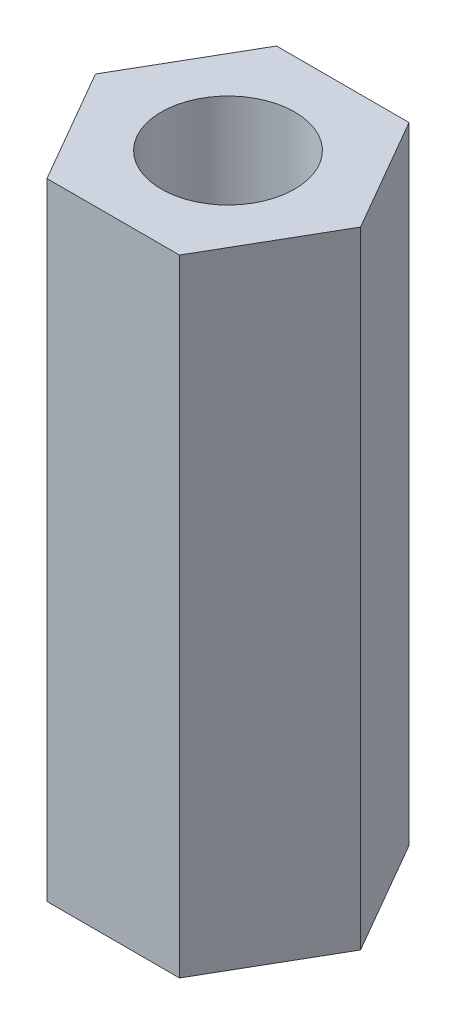
from build123d import *

# Parameters (mm, degrees)
EXTRUDE_1_DEPTH     = 15
SKETCH_2_R          = 1.6
CUT_EXTRUDE_1_DEPTH = 15


with BuildPart() as part:
    # 草图1 → 凸台-拉伸1 (new body)
    with BuildSketch(Plane(origin=(0, 0, 0), x_dir=(1, 0, 0), z_dir=(0, 1, 0))):
        Polygon((3.175426481, 0), (1.58771324, 2.75), (-1.58771324, 2.75), (-3.175426481, 0), (-1.58771324, -2.75), (1.58771324, -2.75), align=None)
    extrude(amount=EXTRUDE_1_DEPTH)

    # 草图2 → 切除-拉伸1 (cut)
    with BuildSketch(Plane.XZ):
        with Locations(Location((0, 0, 0), (0, 0, 270))):
            Circle(SKETCH_2_R)
    extrude(amount=-CUT_EXTRUDE_1_DEPTH, mode=Mode.SUBTRACT)


solid = part.part
